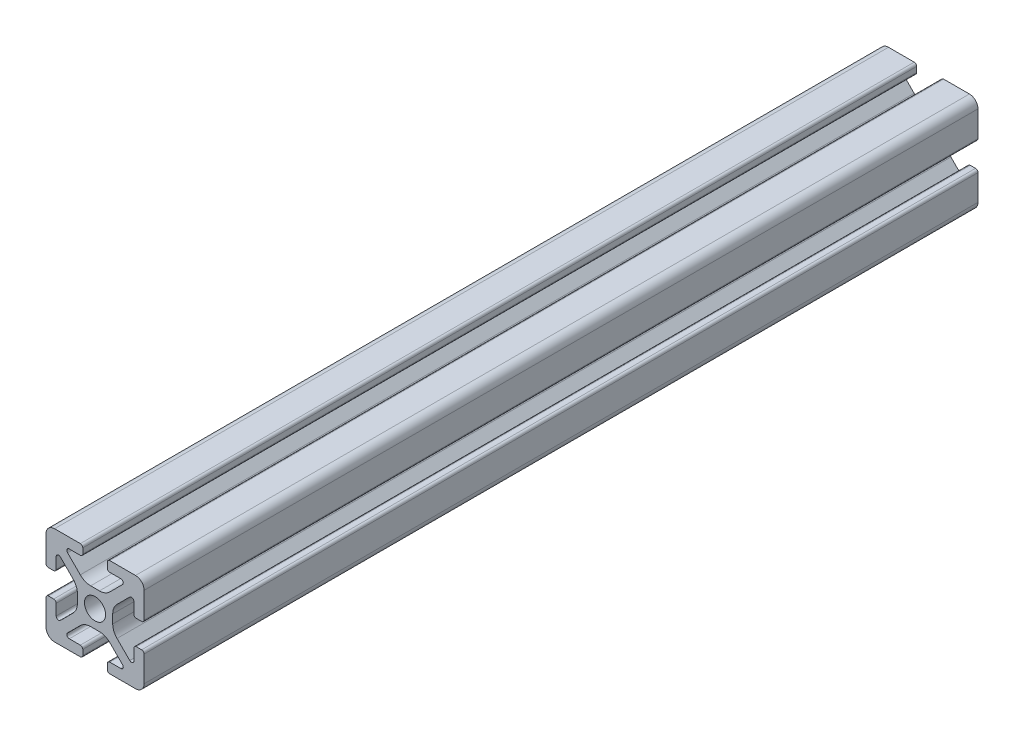
from build123d import *

# Parameters (mm, degrees)
BOSS_EXTRUDE1_DEPTH = 85


with BuildPart() as part:
    # Sketch4 → Boss-Extrude1 (new, symmetric)
    with BuildSketch(Plane.XY):
        with BuildLine():
            Line((3, -10), (8.25, -10))
            ThreePointArc((8.25, -10), (9.487436867, -9.487436867), (10, -8.25))
            Line((10, -8.25), (10, -3))
            ThreePointArc((10, -3), (9.853553391, -2.646446609), (9.5, -2.5))
            Line((9.5, -2.5), (8.424621202, -2.5))
            ThreePointArc((8.424621202, -2.5), (8.071067812, -2.646446609), (7.924621202, -3))
            Line((7.924621202, -3), (7.924621202, -5.25))
            ThreePointArc((7.924621202, -5.25), (7.615962919, -5.711939766), (7.071067812, -5.603553391))
            Line((7.071067812, -5.603553391), (4.478679656, -3.011165235))
            ThreePointArc((4.478679656, -3.011165235), (3.828361402, -2.037895189), (3.6, -0.889844892))
            Line((3.6, -0.889844892), (3.6, 0))
            Line((3.6, 0), (2.15, 0))
            ThreePointArc((2.15, 0), (1.52027958, -1.52027958), (0, -2.15))
            Line((0, -2.15), (0, -3.6))
            Line((0, -3.6), (0.889844892, -3.6))
            ThreePointArc((0.889844892, -3.6), (2.037895189, -3.828361402), (3.011165235, -4.478679656))
            Line((3.011165235, -4.478679656), (5.603553391, -7.071067812))
            ThreePointArc((5.603553391, -7.071067812), (5.711939766, -7.615962919), (5.25, -7.924621202))
            Line((5.25, -7.924621202), (3, -7.924621202))
            ThreePointArc((3, -7.924621202), (2.646446609, -8.071067812), (2.5, -8.424621202))
            Line((2.5, -8.424621202), (2.5, -9.5))
            ThreePointArc((2.5, -9.5), (2.646446609, -9.853553391), (3, -10))
        make_face()
    extrude(amount=BOSS_EXTRUDE1_DEPTH, both=True)

    # Mirror1: part across plane


with BuildPart() as part_1:
    add(part.part)
    add(part.part.mirror(Plane(origin=(0, 0, 0), x_dir=(0, 0, 1), z_dir=(1, 0, 0))))

    # Mirror2: part across plane


with BuildPart() as part_2:
    add(part_1.part)
    add(part_1.part.mirror(Plane.ZX))


solid = part_2.part
